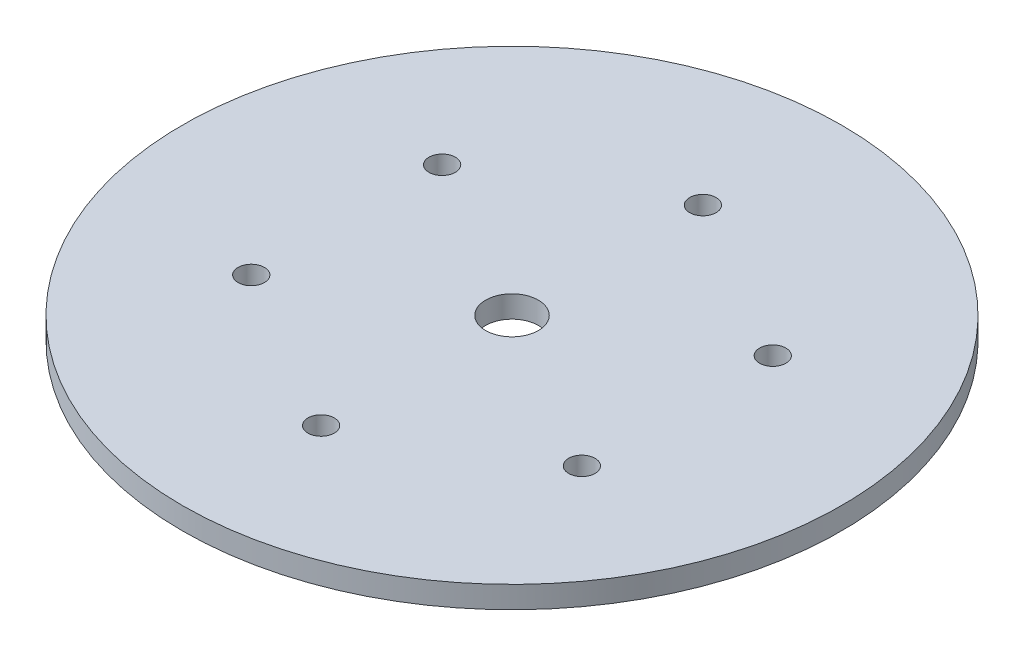
from build123d import *

# Parameters (mm, degrees)
SKETCH1_R           = 75
SKETCH1_R_2         = 3
SKETCH1_R_3         = 6
BOSS_EXTRUDE1_DEPTH = 5


with BuildPart() as part:
    # Sketch1 → Boss-Extrude1 (new body)
    with BuildSketch(Plane(origin=(0, 0, 0), x_dir=(1, 0, 0), z_dir=(0, 1, 0))):
        with Locations(Location((0, 0, 0), (0, 0, 270))):
            Circle(SKETCH1_R)
        with Locations(Location((0, 43.442349597, 0), (0, 0, 270))):
            Circle(SKETCH1_R_2, mode=Mode.SUBTRACT)
        with Locations(Location((37.622178351, 21.721174798, 0), (0, 0, 270))):
            Circle(SKETCH1_R_2, mode=Mode.SUBTRACT)
        with Locations(Location((37.622178351, -21.721174798, 0), (0, 0, 270))):
            Circle(SKETCH1_R_2, mode=Mode.SUBTRACT)
        with Locations(Location((0, -43.442349597, 0), (0, 0, 270))):
            Circle(SKETCH1_R_2, mode=Mode.SUBTRACT)
        with Locations(Location((-37.622178351, -21.721174798, 0), (0, 0, 270))):
            Circle(SKETCH1_R_2, mode=Mode.SUBTRACT)
        with Locations(Location((-37.622178351, 21.721174798, 0), (0, 0, 270))):
            Circle(SKETCH1_R_2, mode=Mode.SUBTRACT)
        with Locations(Location((0, 0, 0), (0, 0, 270))):
            Circle(SKETCH1_R_3, mode=Mode.SUBTRACT)
    extrude(amount=BOSS_EXTRUDE1_DEPTH)


solid = part.part
